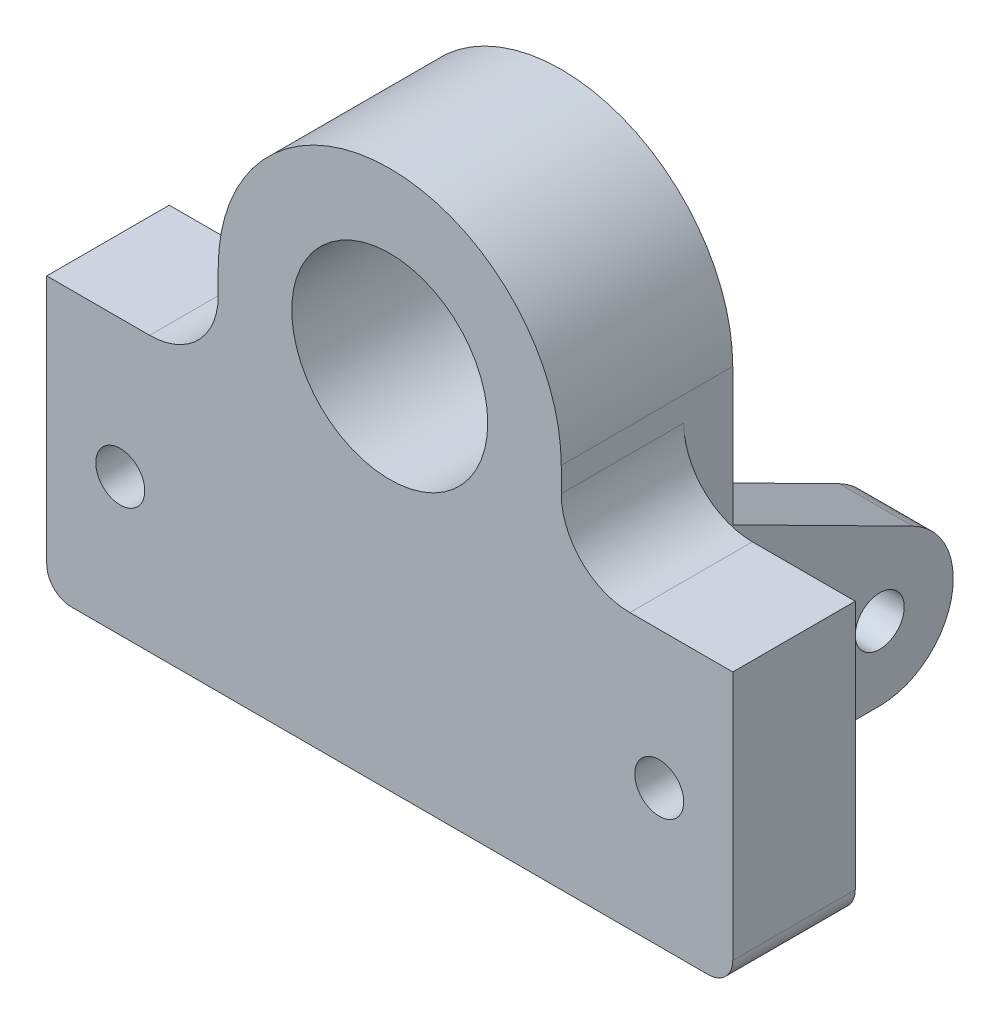
from build123d import *

# Parameters (mm, degrees)
SKETCH1_R           = 5
SKETCH1_R_2         = 20
BOSS_EXTRUDE1_DEPTH = 25
FILLET1_R           = 14
FILLET2_R           = 5
BOSS_EXTRUDE2_START = -10
SKETCH1_3_R         = 20
BOSS_EXTRUDE2_DEPTH = 10
SKETCH3_R           = 5
BOSS_EXTRUDE3_DEPTH = 15


with BuildPart() as part:
    # Sketch1 → Boss-Extrude1 (new body)
    with BuildSketch(Plane.XY):
        with BuildLine():
            Line((-70, 56), (-70, 0))
            Line((-70, 0), (70, 0))
            Line((70, 0), (70, 56))
            Line((70, 56), (35, 56))
            Line((35, 56), (35, 75))
            ThreePointArc((35, 75), (0, 110), (-35, 75))
            Line((-35, 75), (-35, 56))
            Line((-35, 56), (-70, 56))
        make_face()
        with Locations((-55, 28)):
            Circle(SKETCH1_R, mode=Mode.SUBTRACT)
        with Locations((0, 75)):
            Circle(SKETCH1_R_2, mode=Mode.SUBTRACT)
        with Locations((55, 28)):
            Circle(SKETCH1_R, mode=Mode.SUBTRACT)
    extrude(amount=BOSS_EXTRUDE1_DEPTH)

    # Fillet1
    fillet1_edges = [part.edges().sort_by_distance(p)[0] for p in [
        (35, 56, 12.5),
        (-35, 56, 12.5),
    ]]
    fillet(fillet1_edges, radius=FILLET1_R)

    # Fillet2
    fillet2_edges = [part.edges().sort_by_distance(p)[0] for p in [
        (-70, 0, 12.5),
        (70, 0, 12.5),
    ]]
    fillet(fillet2_edges, radius=FILLET2_R)

    # Sketch1<3> → Boss-Extrude2 (add)
    with BuildSketch(Plane.XY.offset(BOSS_EXTRUDE2_START)):
        with BuildLine():
            Line((-35, 56), (-35, 0))
            Line((-35, 0), (35, 0))
            Line((35, 0), (35, 56))
            Line((35, 56), (35, 75))
            ThreePointArc((35, 75), (0, 110), (-35, 75))
            Line((-35, 75), (-35, 56))
        make_face()
        with Locations((0, 75)):
            Circle(SKETCH1_3_R, mode=Mode.SUBTRACT)
    extrude(amount=BOSS_EXTRUDE2_DEPTH)

    # Sketch3 → Boss-Extrude3 (add)
    with BuildSketch(Plane(origin=(35, 0, 0), x_dir=(0, 0, -1), z_dir=(1, 0, 0))):
        with BuildLine():
            Line((10, 47), (10, 0))
            Line((10, 0), (40, 0))
            ThreePointArc((40, 0), (54.590100754, 11.517334354), (46.774992355, 28.382805333))
            Line((46.774992355, 28.382805333), (10, 47))
        make_face()
        with Locations((40, 15)):
            Circle(SKETCH3_R, mode=Mode.SUBTRACT)
    extrude(amount=-BOSS_EXTRUDE3_DEPTH)

    # Mirror1: part across plane


with BuildPart() as part_1:
    add(part.part)
    add(part.part.mirror(Plane(origin=(0, 0, 0), x_dir=(0, 0, 1), z_dir=(1, 0, 0))))


solid = part_1.part
